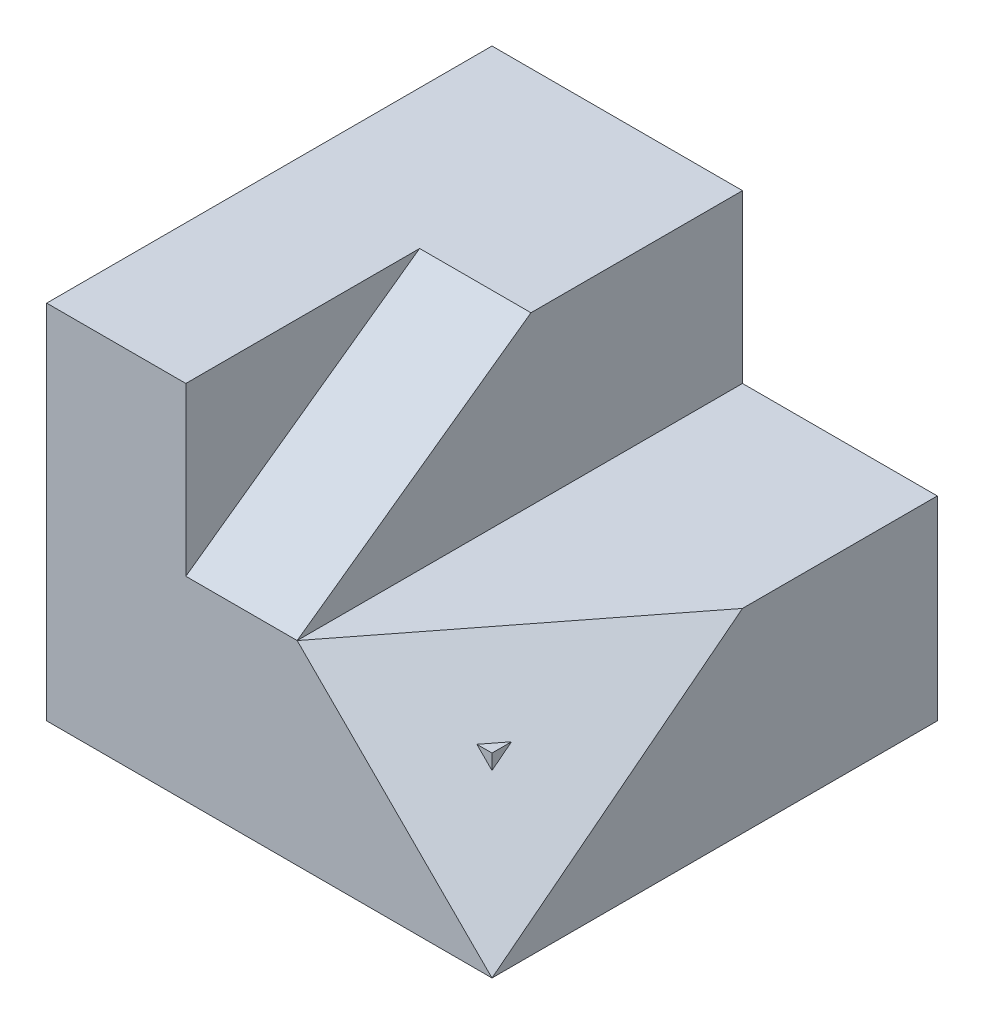
from build123d import *

# Parameters (mm, degrees)
SKETCH1_W           = 80
SKETCH1_H           = 65
BOSS_EXTRUDE1_DEPTH = 80
SKETCH2_W           = 80
SKETCH2_H           = 30
CUT_EXTRUDE1_DEPTH  = 35
CUT_EXTRUDE2_DEPTH  = 20
CUT_EXTRUDE8_DEPTH  = 20


with BuildPart() as part:
    # Sketch1 → Boss-Extrude1 (new body)
    with BuildSketch(Plane.XY):
        Rectangle(SKETCH1_W, SKETCH1_H)
    extrude(amount=-BOSS_EXTRUDE1_DEPTH)

    # Sketch2 → Cut-Extrude1 (cut)
    with BuildSketch(Plane(origin=(40, 0, 0), x_dir=(0, 0, -1), z_dir=(1, 0, 0))):
        with Locations((40, 17.5)):
            Rectangle(SKETCH2_W, SKETCH2_H)
    extrude(amount=-CUT_EXTRUDE1_DEPTH, mode=Mode.SUBTRACT)

    # Sketch3 → Cut-Extrude2 (cut)
    with BuildSketch(Plane(origin=(5, 0, 0), x_dir=(0, 0, -1), z_dir=(1, 0, 0))):
        Polygon((42, 32.5), (0, 32.5), (0, 2.5), align=None)
    extrude(amount=-CUT_EXTRUDE2_DEPTH, mode=Mode.SUBTRACT)

    # Sketch6 → Cut-Extrude8 (cut)
    with BuildSketch(Plane(origin=(2.879146919, 2.879146919, 2.239336493), x_dir=(0.7849291331552356, -0.4890712291198004, -0.38038873375984483), z_dir=(0.6195855517393627, 0.6195855517393629, 0.4818998735750602))):
        Polygon((47.291980273, 37.055701316), (47.291980273, -19.953069939), (2.701967593, 1.534851534), align=None)
    extrude(amount=CUT_EXTRUDE8_DEPTH, mode=Mode.SUBTRACT)


with BuildPart() as cut_extrude8_piece_1:
    # of the separate pieces the step leaves, piece 1, a body of its own (cut_extrude8_pieces)
    add(part.part.solids().sort_by_distance((-40, 32.5, 0))[0])


with BuildPart() as cut_extrude8_piece_2:
    # of the separate pieces the step leaves, piece 2, a body of its own (cut_extrude8_pieces)
    add(part.part.solids().sort_by_distance((40, 2.5, 0))[0])


solid = Compound([cut_extrude8_piece_1.part, cut_extrude8_piece_2.part])
